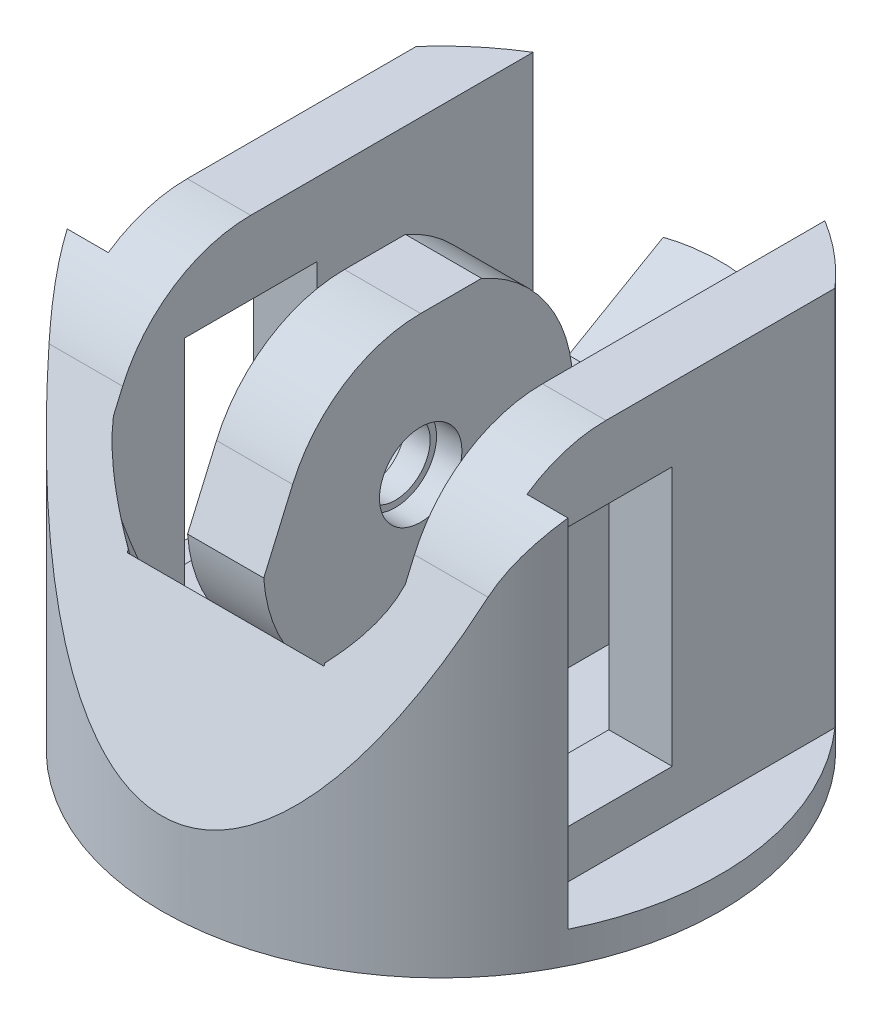
from build123d import *

# Parameters (mm, degrees)
SKETCH_1_R                = 44
EXTRUDE_1_DEPTH           = 80
CUT_EXTRUDE_START         = 5
SKETCH_2_W                = 23
SKETCH_2_H                = 72
CUT_EXTRUDE_5_DEPTH       = 97.350875675
SKETCH_3_W                = 20.9
SKETCH_3_H                = 40.9
CUT_EXTRUDE_6_DEPTH       = 120.436175424
EXTRUDE_2_DEPTH           = 75
SKETCH_7_R                = 6.5
CUT_EXTRUDE_7_DEPTH       = 4
CUT_EXTRUDE_START_2       = -4
SKETCH_8_R                = 6.5
CUT_EXTRUDE_8_DEPTH       = 4
CUT_EXTRUDE_9_REACH       = 105.057
SKETCH_9_R                = 5.5
CUT_EXTRUDE_10_DEPTH      = 120.436175424
CUT_EXTRUDE_10_DEPTH_BACK = 120.436175424
CUT_EXTRUDE_START_3       = -12
CUT_EXTRUDE_13_DEPTH      = 12
CUT_EXTRUDE_14_REACH      = 96.265
CUT_REVOLVE_1_ANGLE       = 180
CUT_REVOLVE_2_ANGLE       = 180
CUT_EXTRUDE_20_REACH      = 93.901


with BuildPart() as part:
    # 草图1 → 凸台-拉伸1 (new body)
    with BuildSketch(Plane(origin=(0, 0, 0), x_dir=(1, 0, 0), z_dir=(0, 1, 0))):
        with Locations(Location((0, 0, 0), (0, 0, 270))):
            Circle(SKETCH_1_R)
    extrude(amount=EXTRUDE_1_DEPTH)

    # 草图2 → 切除-拉伸5 (cut, through all)
    with BuildSketch(Plane(origin=(0, 0, 0), x_dir=(1, 0, 0), z_dir=(0, 1, 0)).offset(CUT_EXTRUDE_START)):
        with BuildLine():
            Line((33, 29.103264422), (33, -19.45))
            Line((33, -19.45), (39.467676648, -19.45))
            ThreePointArc((39.467676648, -19.45), (43.614744195, 5.809826917), (33, 29.103264422))
        make_face()
        with Locations((11.5, 8)):
            Rectangle(SKETCH_2_W, SKETCH_2_H)
    cut_extrude_5 = extrude(amount=CUT_EXTRUDE_5_DEPTH, mode=Mode.SUBTRACT)

    # 镜向1: 切除-拉伸5 across plane
    add(cut_extrude_5.mirror(Plane(origin=(0, 0, 0), x_dir=(0, 0, 1), z_dir=(1, 0, 0))), mode=Mode.SUBTRACT)

    # 草图3 → 切除-拉伸6 (cut, through all)
    with BuildSketch(Plane(origin=(33, 0, 0), x_dir=(0, 0, -1), z_dir=(1, 0, 0))):
        with Locations((-7, 33)):
            Rectangle(SKETCH_3_W, SKETCH_3_H)
    extrude(amount=-CUT_EXTRUDE_6_DEPTH, mode=Mode.SUBTRACT)

    # 草图6 → 凸台-拉伸2 (add)
    with BuildSketch(Plane(origin=(0, 5, 0), x_dir=(1, 0, 0), z_dir=(0, 1, 0))):
        with BuildLine():
            Line((-8.2, 43.229156827), (-8.2, -28))
            Line((-8.2, -28), (3.8, -28))
            Line((3.8, -28), (3.8, 43.835601969))
            ThreePointArc((3.8, 43.835601969), (-2.220798038, 43.943919444), (-8.2, 43.229156827))
        make_face()
    extrude(amount=EXTRUDE_2_DEPTH)

    # 草图7 → 切除-拉伸7 (cut)
    with BuildSketch(Plane(origin=(3.8, 0, 0), x_dir=(0, 0, -1), z_dir=(1, 0, 0))):
        with Locations((-7, 43)):
            Circle(SKETCH_7_R)
    extrude(amount=-CUT_EXTRUDE_7_DEPTH, mode=Mode.SUBTRACT)

    # 草图8 → 切除-拉伸8 (cut)
    with BuildSketch(Plane.ZY.offset(8.2).offset(CUT_EXTRUDE_START_2)):
        with Locations(Location((7, 43, 0), (0, 0, 180))):
            Circle(SKETCH_8_R)
    extrude(amount=CUT_EXTRUDE_8_DEPTH, mode=Mode.SUBTRACT)

    # 草图9 → 切除-拉伸9 (cut, up to next)
    with BuildSketch(Plane(origin=(3.8, 0, 0), x_dir=(0, 0, -1), z_dir=(1, 0, 0)), mode=Mode.PRIVATE) as cut_extrude_9_sk1:
        with Locations((-7, 43)):
            Circle(SKETCH_9_R)
    cut_extrude_9_tool1 = extrude(cut_extrude_9_sk1.sketch, amount=-CUT_EXTRUDE_9_REACH, mode=Mode.PRIVATE) & part.part
    add(cut_extrude_9_tool1.solids().sort_by_distance((3.8, 43, 7))[0], mode=Mode.SUBTRACT)

    # 草图10 → 切除-拉伸10 (cut, two sides: drawn at the far end of the back side and taken through both)
    with BuildSketch(Plane(origin=(33, 0, 0), x_dir=(0, 0, -1), z_dir=(1, 0, 0)).offset(-CUT_EXTRUDE_10_DEPTH_BACK)):
        with BuildLine():
            Line((44, 80), (44, 65))
            Line((44, 65), (-7, 65))
            ThreePointArc((-7, 65), (-19.069252989, 61.393834083), (-27.181803363, 51.757557481))
            Line((-27.181803363, 51.757557481), (-44, 13))
            Line((-44, 13), (-44, 80))
            Line((-44, 80), (44, 80))
        make_face()
    extrude(amount=CUT_EXTRUDE_10_DEPTH + CUT_EXTRUDE_10_DEPTH_BACK, mode=Mode.SUBTRACT)

    # 草图18 → 切除-拉伸13 (cut)
    with BuildSketch(Plane.ZY.offset(8.2).offset(CUT_EXTRUDE_START_3)):
        with BuildLine():
            ThreePointArc((-16.994306564, 43.522735592), (-16.113193955, 49.463765557), (-13.784609691, 55))
            ThreePointArc((-13.784609691, 55), (-8.989980812, 60.897500207), (-2.591663047, 65))
            Line((-2.591663047, 65), (-21.495613698, 65))
            ThreePointArc((-21.495613698, 65), (-26.943692062, 54.992738185), (-28.991459846, 43.784103388))
            Line((-28.991459846, 43.784103388), (-16.994306564, 43.522735592))
        make_face()
    extrude(amount=CUT_EXTRUDE_13_DEPTH, mode=Mode.SUBTRACT)

    # 草图19 → 切除-拉伸14 (cut, up to next)
    with BuildSketch(Plane.ZY.offset(8.2), mode=Mode.PRIVATE) as cut_extrude_14_sk1:
        with BuildLine():
            Line((-25.784609691, 34.215390309), (-20.368569743, 43.596246675))
            Line((-20.368569743, 43.596246675), (-28.991459846, 43.784103388))
            ThreePointArc((-28.991459846, 43.784103388), (-26.943692062, 54.992738185), (-21.495613698, 65))
            Line((-21.495613698, 65), (-43.229156827, 65))
            Line((-43.229156827, 65), (-43.229156827, 44.287004294))
            Line((-43.229156827, 44.287004294), (-25.784609691, 34.215390309))
        make_face()
    cut_extrude_14_tool1 = extrude(cut_extrude_14_sk1.sketch, amount=-CUT_EXTRUDE_14_REACH, mode=Mode.PRIVATE) & part.part
    # 草图19 → 切除-拉伸14 (cut, up to next)
    with BuildSketch(Plane.ZY.offset(8.2), mode=Mode.PRIVATE) as cut_extrude_14_sk2:
        with BuildLine():
            Line((-20.368569743, 43.596246675), (-13.784609691, 55))
            Line((-13.784609691, 55), (-13.784609691, 93.841822502))
            Line((-13.784609691, 93.841822502), (-75.156898342, 93.841822502))
            Line((-75.156898342, 93.841822502), (-75.156898342, 62.720494453))
            Line((-75.156898342, 62.720494453), (-43.229156827, 44.287004294))
            Line((-43.229156827, 44.287004294), (-43.229156827, 65))
            Line((-43.229156827, 65), (-21.495613698, 65))
            ThreePointArc((-21.495613698, 65), (-26.943692062, 54.992738185), (-28.991459846, 43.784103388))
            Line((-28.991459846, 43.784103388), (-20.368569743, 43.596246675))
        make_face()
    cut_extrude_14_tool2 = extrude(cut_extrude_14_sk2.sketch, amount=-CUT_EXTRUDE_14_REACH, mode=Mode.PRIVATE) & part.part
    add(cut_extrude_14_tool1.solids().sort_by_distance((-8.2, 51.836761, -33.537679))[0], mode=Mode.SUBTRACT)
    add(cut_extrude_14_tool2.solids().sort_by_distance((-8.2, 73.617285, -43.768646))[0], mode=Mode.SUBTRACT)

    # 草图24 → 切除-旋转1 (revolve, symmetric, cut)
    with BuildSketch(Plane(origin=(0, 43, 0), x_dir=(-1, 0, 0), z_dir=(0, -1, 0))) as cut_revolve_1_sk:
        Polygon((15.5, -31.8), (15.5, -34.8), (-15.5, -34.8), (-15.5, -31.8), (-15.5, -7), (-3.8, -7), (-3.8, -31.8), (8.2, -31.8), (8.2, -7), (15.5, -7), align=None)
    revolve(axis=Axis((-101.499852898, 43, 7), (1, 0, 0)), revolution_arc=CUT_REVOLVE_1_ANGLE / 2, mode=Mode.SUBTRACT)
    revolve(cut_revolve_1_sk.sketch, axis=Axis((-101.499852898, 43, 7), (-1, 0, 0)), revolution_arc=CUT_REVOLVE_1_ANGLE / 2, mode=Mode.SUBTRACT)

    # 草图26 → 切除-旋转2 (revolve, symmetric, cut)
    with BuildSketch(Plane(origin=(0, 43, 0), x_dir=(1, 0, 0), z_dir=(0, 1, 0))) as cut_revolve_2_sk:
        Polygon((-15.5, -34.551556537), (-23, -29.3), (-23, -28), (-15.5, -28), align=None)
        Polygon((15.5, -34.551556537), (23, -29.3), (23, -28), (15.5, -28), align=None)
    revolve(axis=Axis((-28, 43, 7), (1, 0, 0)), revolution_arc=CUT_REVOLVE_2_ANGLE / 2, mode=Mode.SUBTRACT)
    revolve(cut_revolve_2_sk.sketch, axis=Axis((-28, 43, 7), (-1, 0, 0)), revolution_arc=CUT_REVOLVE_2_ANGLE / 2, mode=Mode.SUBTRACT)

    # 草图28 → 切除-拉伸20 (cut, up to next)
    with BuildSketch(Plane(origin=(3.8, 0, 0), x_dir=(0, 0, -1), z_dir=(1, 0, 0)), mode=Mode.PRIVATE) as cut_extrude_20_sk1:
        with BuildLine():
            ThreePointArc((-7, 15.2), (-6.737382717, 15.201240456), (-6.474788871, 15.204961715))
            Line((-6.474788871, 15.204961715), (-5.365047446, 18.253951222))
            ThreePointArc((-5.365047446, 18.253951222), (-6.182078765, 18.213491475), (-7, 18.2))
            Line((-7, 18.2), (-7, 15.2))
        make_face()
    cut_extrude_20_tool1 = extrude(cut_extrude_20_sk1.sketch, amount=-CUT_EXTRUDE_20_REACH, mode=Mode.PRIVATE) & part.part
    add(cut_extrude_20_tool1.solids().sort_by_distance((3.8, 16.966985, 6.413126))[0], mode=Mode.SUBTRACT)


solid = part.part
